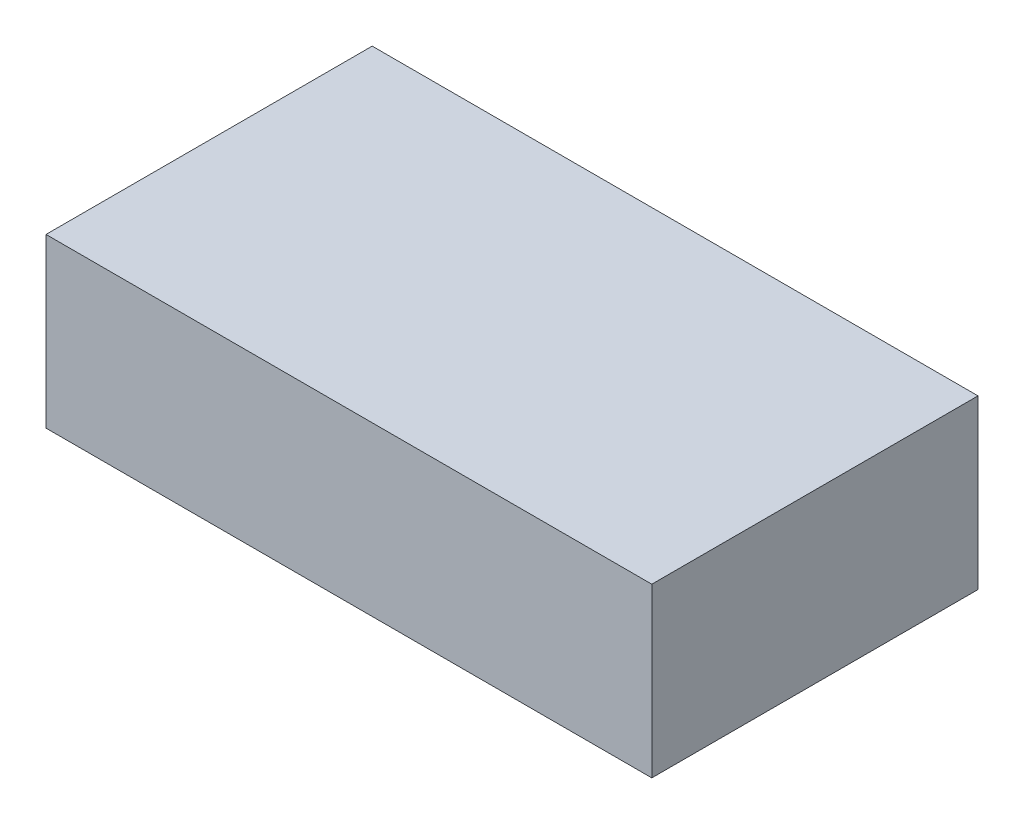
from build123d import *

# Parameters (mm, degrees)
SKETCH1_W           = 65
SKETCH1_H           = 35
BOSS_EXTRUDE1_DEPTH = 18


with BuildPart() as part:
    # Sketch1 → Boss-Extrude1 (new body)
    with BuildSketch(Plane(origin=(0, 0, 0), x_dir=(1, 0, 0), z_dir=(0, 1, 0))):
        Rectangle(SKETCH1_W, SKETCH1_H)
    extrude(amount=BOSS_EXTRUDE1_DEPTH)


solid = part.part
